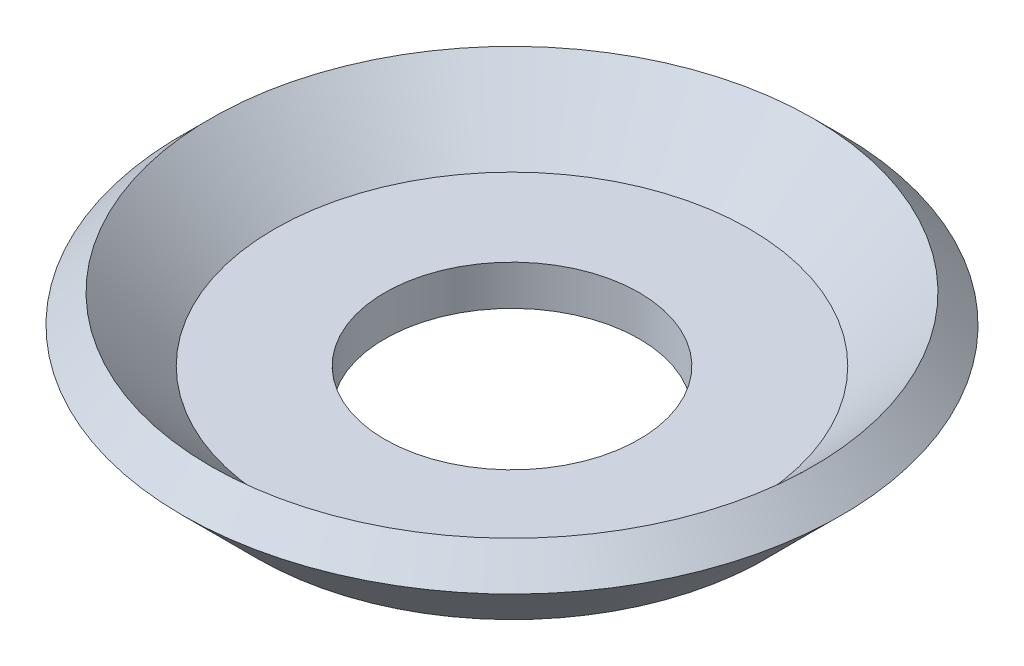
from build123d import *


with BuildPart() as part:
    # Sketch1 → Revolve1 (revolve)
    with BuildSketch(Plane(origin=(0, 0, 0), x_dir=(0, 0, -1), z_dir=(1, 0, 0)), mode=Mode.PRIVATE) as revolve1_sk:
        Polygon((-4.7625, 0), (-9.511320344, 0), (-12.339747468, 2.828427125), (-11.279087297, 3.889087297), (-8.89, 1.5), (-4.7625, 1.5), align=None)
    revolve(revolve1_sk.sketch.rotate(Axis((0, 0, 0), (0, 1, 0)), 180), axis=Axis((0, 0, 0), (0, 1, 0)))


solid = part.part
